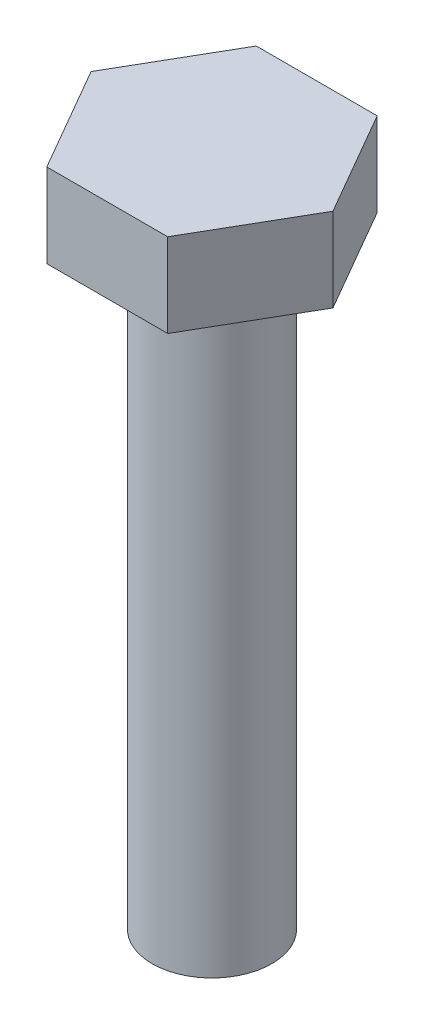
from build123d import *

# Parameters (mm, degrees)
SKETCH_1_R      = 2
EXTRUDE_1_DEPTH = 20
EXTRUDE_2_DEPTH = 2.8


with BuildPart() as part:
    # 草图1 → 凸台-拉伸1 (new body)
    with BuildSketch(Plane(origin=(0, 0, 0), x_dir=(1, 0, 0), z_dir=(0, 1, 0))):
        with Locations(Location((0, 0, 0), (0, 0, 270))):
            Circle(SKETCH_1_R)
    extrude(amount=EXTRUDE_1_DEPTH)

    # 草图2 → 凸台-拉伸2 (add)
    with BuildSketch(Plane(origin=(0, 20, 0), x_dir=(1, 0, 0), z_dir=(0, 1, 0))):
        Polygon((4.041451884, 0), (2.020725942, 3.5), (-2.020725942, 3.5), (-4.041451884, 0), (-2.020725942, -3.5), (2.020725942, -3.5), align=None)
    extrude(amount=EXTRUDE_2_DEPTH)


solid = part.part
